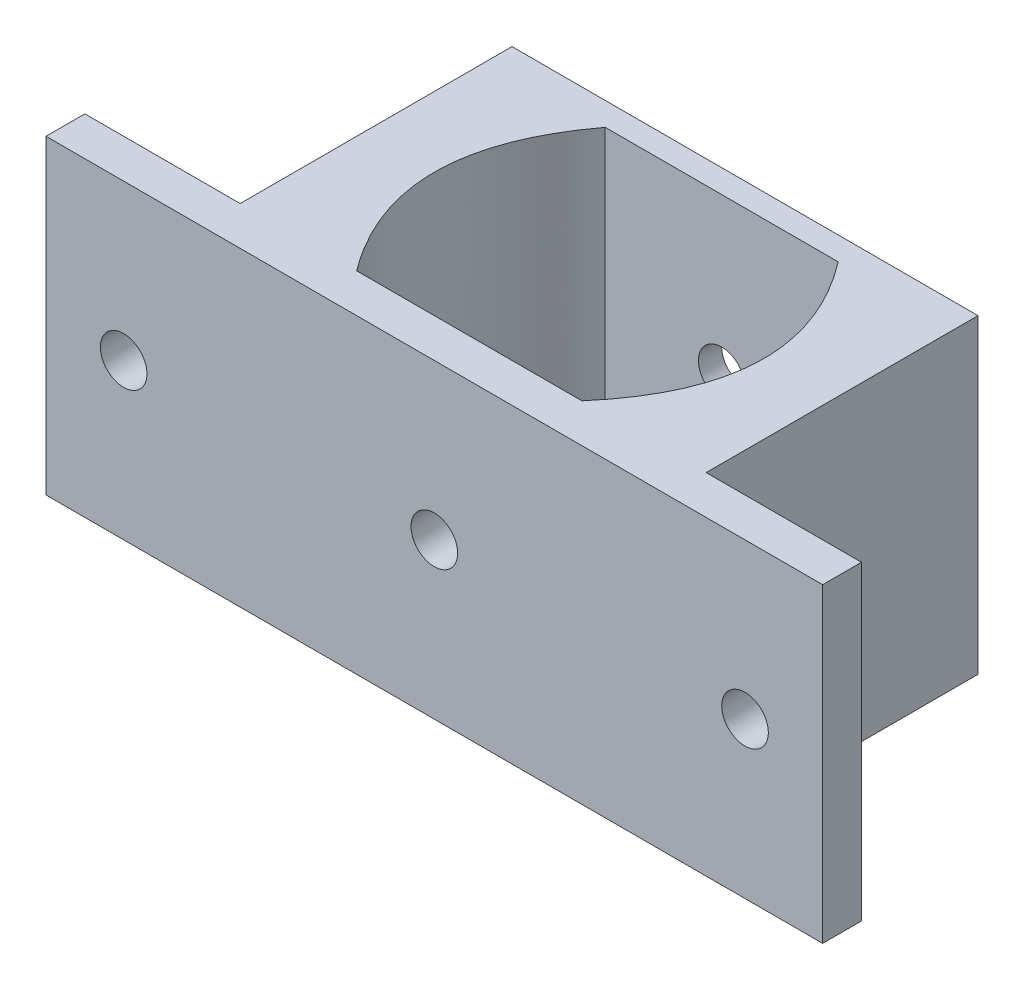
from build123d import *

# Parameters (mm, degrees)
BOSS_EXTRUDE3_DEPTH  = 20
SKETCH3_W            = 10
SKETCH3_H            = 2.5
BOSS_EXTRUDE4_DEPTH  = 20
SKETCH4_R            = 1.5
CUT_EXTRUDE1_DEPTH   = 3
BOSS_EXTRUDE5_DEPTH  = 20
SKETCH6_W            = 20
SKETCH6_H            = 0.5
CUT_EXTRUDE2_DEPTH   = 20
BOSS_EXTRUDE11_DEPTH = 20
CUT_EXTRUDE4_DEPTH   = 20
SKETCH11_W           = 20
SKETCH11_H           = 0.5
CUT_EXTRUDE5_DEPTH   = 20
BOSS_EXTRUDE14_DEPTH = 20
CUT_EXTRUDE9_DEPTH   = 20
CUT_EXTRUDE12_DEPTH  = 20
CUT_EXTRUDE13_DEPTH  = 20
BOSS_EXTRUDE16_DEPTH = 20
BOSS_EXTRUDE17_DEPTH = 20
CUT_EXTRUDE14_DEPTH  = 20


with BuildPart() as part:
    # Sketch1 → Boss-Extrude3 (new body)
    with BuildSketch(Plane(origin=(0, 0, 0), x_dir=(1, 0, 0), z_dir=(0, 1, 0))):
        with BuildLine():
            add(Edge.make_bspline(
                [(-8.130019969, 7.5), (-11.130019969, 3.75), (-11.130019969, 0)],
                knots=[0, 0, 0, 0.5, 0.5, 0.5], degree=2))
            Line((-8.130019969, 7.5), (-13.130019969, 7.5))
            Line((-13.130019969, 7.5), (-13.130019969, -10))
            Line((-13.130019969, -10), (16.869980031, -10))
            Line((16.869980031, -10), (16.869980031, -7.5))
            Line((16.869980031, -7.5), (11.869980031, -7.5))
            Line((11.869980031, -7.5), (-8.130019969, -7.5))
            add(Edge.make_bspline(
                [(-11.130019969, 0), (-11.130019969, -3.75), (-8.130019969, -7.5)],
                knots=[0.5, 0.5, 0.5, 1, 1, 1], degree=2))
        make_face()
        with BuildLine():
            Line((-13.130019969, 7.5), (-8.130019969, 7.5))
            Line((-8.130019969, 7.5), (11.869980031, 7.5))
            add(Edge.make_bspline(
                [(11.869980031, 7.5), (14.869980031, 3.75), (14.869980031, 0)],
                knots=[0, 0, 0, 0.5, 0.5, 0.5], degree=2))
            add(Edge.make_bspline(
                [(14.869980031, 0), (14.869980031, -3.75), (11.869980031, -7.5)],
                knots=[0.5, 0.5, 0.5, 1, 1, 1], degree=2))
            Line((11.869980031, -7.5), (16.869980031, -7.5))
            Line((16.869980031, -7.5), (16.869980031, 10))
            Line((16.869980031, 10), (-13.130019969, 10))
            Line((-13.130019969, 10), (-13.130019969, 7.5))
        make_face()
    extrude(amount=BOSS_EXTRUDE3_DEPTH)

    # Sketch3 → Boss-Extrude4 (add)
    with BuildSketch(Plane(origin=(0, 20, 0), x_dir=(1, 0, 0), z_dir=(0, 1, 0))):
        with Locations((-18.130019969, -8.75)):
            Rectangle(SKETCH3_W, SKETCH3_H)
        with Locations((21.869980031, -8.75)):
            Rectangle(SKETCH3_W, SKETCH3_H)
    extrude(amount=-BOSS_EXTRUDE4_DEPTH)

    # Sketch4 → Cut-Extrude1 (cut)
    with BuildSketch(Plane(origin=(0, 0, 7.5), x_dir=(-1, 0, 0), z_dir=(0, 0, -1))):
        with Locations((18.130019969, 10)):
            Circle(SKETCH4_R)
        with Locations((-21.869980031, 10)):
            Circle(SKETCH4_R)
    extrude(amount=-CUT_EXTRUDE1_DEPTH, mode=Mode.SUBTRACT)

    # Sketch5 → Boss-Extrude5 (add)
    with BuildSketch(Plane(origin=(0, 20, 0), x_dir=(1, 0, 0), z_dir=(0, 1, 0))):
        with BuildLine():
            Line((-8.130019969, 7.5), (-8.130019969, -7.5))
            add(Edge.make_bspline(
                [(-8.130019969, -7.5), (-14.130019969, 0), (-8.130019969, 7.5)],
                knots=[0, 0, 0, 1, 1, 1], degree=2))
        make_face()
        with BuildLine():
            Line((11.869980031, 7.5), (11.869980031, -7.5))
            add(Edge.make_bspline(
                [(11.869980031, 7.5), (17.869980031, 0), (11.869980031, -7.5)],
                knots=[0, 0, 0, 1, 1, 1], degree=2))
        make_face()
    extrude(amount=-BOSS_EXTRUDE5_DEPTH)

    # Sketch6 → Cut-Extrude2 (cut)
    with BuildSketch(Plane(origin=(0, 20, 0), x_dir=(1, 0, 0), z_dir=(0, 1, 0))):
        with Locations((1.869980031, 7.75)):
            Rectangle(SKETCH6_W, SKETCH6_H)
    extrude(amount=-CUT_EXTRUDE2_DEPTH, mode=Mode.SUBTRACT)

    # Sketch8 → Boss-Extrude11 (add)
    with BuildSketch(Plane(origin=(0, 20, 0), x_dir=(1, 0, 0), z_dir=(0, 1, 0))):
        with BuildLine():
            Line((-5.130019969, 8), (-8.130019969, 8))
            Line((-8.130019969, 8), (-8.130019969, 0.25))
            add(Edge.make_bspline(
                [(-8.130019969, 0.25), (-8.130019969, 4.125), (-5.130019969, 8)],
                knots=[0.5, 0.5, 0.5, 1, 1, 1], degree=2))
        make_face()
        with BuildLine():
            add(Edge.make_bspline(
                [(-5.130019969, -7.5), (-8.130019969, -3.625), (-8.130019969, 0.25)],
                knots=[0, 0, 0, 0.5, 0.5, 0.5], degree=2))
            Line((-8.130019969, 0.25), (-8.130019969, -7.5))
            Line((-8.130019969, -7.5), (-5.130019969, -7.5))
        make_face()
        with BuildLine():
            Line((11.869980031, 8), (8.869980031, 8))
            add(Edge.make_bspline(
                [(8.869980031, 8), (11.869980028, 4.125000005), (11.869980031, 0.25000001)],
                knots=[0, 0, 0, 0.499999999, 0.499999999, 0.499999999], degree=2))
            Line((11.869980031, 0.25000001), (11.869980031, 8))
        make_face()
        with BuildLine():
            Line((11.869980031, -7.5), (11.869980031, 0.25000001))
            add(Edge.make_bspline(
                [(11.869980031, 0.25000001), (11.869980035, -3.624999995), (8.869980031, -7.5)],
                knots=[0.499999999, 0.499999999, 0.499999999, 1, 1, 1], degree=2))
            Line((8.869980031, -7.5), (11.869980031, -7.5))
        make_face()
    extrude(amount=-BOSS_EXTRUDE11_DEPTH)

    # Sketch10 → Cut-Extrude4 (cut)
    with BuildSketch(Plane(origin=(0, 20, 0), x_dir=(1, 0, 0), z_dir=(0, 1, 0))):
        with BuildLine():
            add(Edge.make_bspline(
                [(-8.130019969, 0.25), (-8.130019969, 4.125), (-5.130019969, 8)],
                knots=[0.5, 0.5, 0.5, 1, 1, 1], degree=2))
            Line((-5.130019969, 8), (-8.130019969, 8))
            Line((-8.130019969, 8), (-8.130019969, 0.25))
        make_face()
        with BuildLine():
            Line((-8.130019969, -7.5), (-5.130019969, -7.5))
            add(Edge.make_bspline(
                [(-5.130019969, -7.5), (-8.130019969, -3.625), (-8.130019969, 0.25)],
                knots=[0, 0, 0, 0.5, 0.5, 0.5], degree=2))
            Line((-8.130019969, 0.25), (-8.130019969, -7.5))
        make_face()
        with BuildLine():
            add(Edge.make_bspline(
                [(11.869980031, 0.25000001), (11.869980035, -3.624999995), (8.869980031, -7.5)],
                knots=[0.499999999, 0.499999999, 0.499999999, 1, 1, 1], degree=2))
            Line((8.869980031, -7.5), (11.869980031, -7.5))
            Line((11.869980031, -7.5), (11.869980031, 0.25000001))
        make_face()
        with BuildLine():
            Line((11.869980031, 8), (8.869980031, 8))
            add(Edge.make_bspline(
                [(8.869980031, 8), (11.869980028, 4.125000005), (11.869980031, 0.25000001)],
                knots=[0, 0, 0, 0.499999999, 0.499999999, 0.499999999], degree=2))
            Line((11.869980031, 0.25000001), (11.869980031, 8))
        make_face()
    extrude(amount=-CUT_EXTRUDE4_DEPTH, mode=Mode.SUBTRACT)

    # Sketch11 → Cut-Extrude5 (cut)
    with BuildSketch(Plane(origin=(0, 20, 0), x_dir=(1, 0, 0), z_dir=(0, 1, 0))):
        with Locations((1.869980031, 8.25)):
            Rectangle(SKETCH11_W, SKETCH11_H)
    extrude(amount=-CUT_EXTRUDE5_DEPTH, mode=Mode.SUBTRACT)

    # Sketch12 → Boss-Extrude14 (add)
    with BuildSketch(Plane(origin=(0, 20, 0), x_dir=(1, 0, 0), z_dir=(0, 1, 0))):
        with BuildLine():
            Line((-8.130019969, 8.5), (-8.130019969, 0.5))
            add(Edge.make_bspline(
                [(-5.130019969, 8.5), (-8.130019969, 4.5), (-8.130019969, 0.5)],
                knots=[0, 0, 0, 0.5, 0.5, 0.5], degree=2))
            Line((-5.130019969, 8.5), (-8.130019969, 8.5))
        make_face()
        with BuildLine():
            add(Edge.make_bspline(
                [(-8.130019969, 0.5), (-8.130019969, -3.5), (-5.130019969, -7.5)],
                knots=[0.5, 0.5, 0.5, 1, 1, 1], degree=2))
            Line((-8.130019969, 0.5), (-8.130019969, -7.5))
            Line((-8.130019969, -7.5), (-5.130019969, -7.5))
        make_face()
        with BuildLine():
            add(Edge.make_bspline(
                [(11.869980031, 0.5), (11.869980031, -3.5), (8.869980031, -7.5)],
                knots=[0.5, 0.5, 0.5, 1, 1, 1], degree=2))
            Line((8.869980031, -7.5), (11.869980031, -7.5))
            Line((11.869980031, -7.5), (11.869980031, 0.5))
        make_face()
        with BuildLine():
            Line((11.869980031, 8.5), (8.869980031, 8.5))
            add(Edge.make_bspline(
                [(8.869980031, 8.5), (11.869980031, 4.5), (11.869980031, 0.5)],
                knots=[0, 0, 0, 0.5, 0.5, 0.5], degree=2))
            Line((11.869980031, 0.5), (11.869980031, 8.5))
        make_face()
    extrude(amount=-BOSS_EXTRUDE14_DEPTH)

    # Sketch14 → Cut-Extrude9 (cut)
    with BuildSketch(Plane.XY.offset(10)):
        with BuildLine():
            ThreePointArc((0.369980031, 10), (0.80931986, 8.939339828), (1.869980031, 8.5))
            Line((1.869980031, 8.5), (1.869980031, 10))
            Line((1.869980031, 10), (0.369980031, 10))
        make_face()
        with BuildLine():
            Line((1.869980031, 10), (1.869980031, 8.5))
            ThreePointArc((1.869980031, 8.5), (2.930640203, 8.939339828), (3.369980031, 10))
            ThreePointArc((3.369980031, 10), (1.869980031, 11.5), (0.369980031, 10))
            Line((0.369980031, 10), (1.869980031, 10))
        make_face()
        with BuildLine():
            ThreePointArc((0.369980031, 10), (0.80931986, 8.939339828), (1.869980031, 8.5))
            Line((1.869980031, 8.5), (1.869980031, 10))
            Line((1.869980031, 10), (0.369980031, 10))
        make_face()
        with BuildLine():
            Line((1.869980031, 10), (1.869980031, 8.5))
            ThreePointArc((1.869980031, 8.5), (2.930640203, 8.939339828), (3.369980031, 10))
            ThreePointArc((3.369980031, 10), (1.869980031, 11.5), (0.369980031, 10))
            Line((0.369980031, 10), (1.869980031, 10))
        make_face()
    extrude(amount=-CUT_EXTRUDE9_DEPTH, mode=Mode.SUBTRACT)

    # Sketch15 → Cut-Extrude12 (cut)
    with BuildSketch(Plane(origin=(0, 20, 0), x_dir=(1, 0, 0), z_dir=(0, 1, 0))):
        with BuildLine():
            add(Edge.make_bspline(
                [(-5.130019969, 8.5), (-8.130019937, 4.500000043), (-8.130019969, 0.500000085)],
                knots=[0, 0, 0, 0.499999995, 0.499999995, 0.499999995], degree=2))
            Line((-5.130019969, 8.5), (-5.630019969, 8.5))
            add(Edge.make_bspline(
                [(-5.630019969, 8.5), (-8.130019942, 4.500000043), (-8.130019969, 0.500000085)],
                knots=[0, 0, 0, 0.499999995, 0.499999995, 0.499999995], degree=2))
        make_face()
        with BuildLine():
            add(Edge.make_bspline(
                [(-8.130019969, 0.500000085), (-8.13002, -3.499999957), (-5.130019969, -7.5)],
                knots=[0.499999995, 0.499999995, 0.499999995, 1, 1, 1], degree=2))
            add(Edge.make_bspline(
                [(-8.130019969, 0.500000085), (-8.130019995, -3.499999957), (-5.630019969, -7.5)],
                knots=[0.499999995, 0.499999995, 0.499999995, 1, 1, 1], degree=2))
            Line((-5.630019969, -7.5), (-5.130019969, -7.5))
        make_face()
        with BuildLine():
            Line((-4.630019969, 8.5), (-5.130019969, 8.5))
            add(Edge.make_bspline(
                [(-5.130019969, 8.5), (-8.130019937, 4.500000043), (-8.130019969, 0.500000085)],
                knots=[0, 0, 0, 0.499999995, 0.499999995, 0.499999995], degree=2))
            add(Edge.make_bspline(
                [(-8.130019969, 0.500000085), (-8.13002, -3.499999957), (-5.130019969, -7.5)],
                knots=[0.499999995, 0.499999995, 0.499999995, 1, 1, 1], degree=2))
            Line((-5.130019969, -7.5), (-4.630019969, -7.5))
            Line((-4.630019969, -7.5), (-4.630019969, 8.5))
        make_face()
    extrude(amount=-CUT_EXTRUDE12_DEPTH, mode=Mode.SUBTRACT)

    # Sketch17 → Cut-Extrude13 (cut)
    with BuildSketch(Plane(origin=(0, 20, 0), x_dir=(1, 0, 0), z_dir=(0, 1, 0))):
        with BuildLine():
            add(Edge.make_bspline(
                [(-8.130019969, 0.5), (-8.130019968, 4.5), (-5.630019969, 8.5)],
                knots=[0.5, 0.5, 0.5, 1, 1, 1], degree=2))
            add(Edge.make_bspline(
                [(-5.630019969, 8.5), (-8.630019969, 4.5), (-8.630019969, 0.5)],
                knots=[0, 0, 0, 0.5, 0.5, 0.5], degree=2))
            Line((-8.630019969, 0.5), (-8.130019969, 0.5))
        make_face()
        with BuildLine():
            Line((-8.130019969, 0.5), (-8.630019969, 0.5))
            add(Edge.make_bspline(
                [(-8.630019969, 0.5), (-8.630019969, -3.5), (-5.630019969, -7.5)],
                knots=[0.5, 0.5, 0.5, 1, 1, 1], degree=2))
            add(Edge.make_bspline(
                [(-5.630019969, -7.5), (-8.130019969, -3.5), (-8.130019969, 0.5)],
                knots=[0, 0, 0, 0.5, 0.5, 0.5], degree=2))
        make_face()
        with BuildLine():
            add(Edge.make_bspline(
                [(-8.130019969, 0.5), (-8.130019968, 4.5), (-5.630019969, 8.5)],
                knots=[0.5, 0.5, 0.5, 1, 1, 1], degree=2))
            add(Edge.make_bspline(
                [(-5.630019969, 8.5), (-8.630019969, 4.5), (-8.630019969, 0.5)],
                knots=[0, 0, 0, 0.5, 0.5, 0.5], degree=2))
            Line((-8.630019969, 0.5), (-8.130019969, 0.5))
        make_face()
        with BuildLine():
            Line((-8.130019969, 0.5), (-8.630019969, 0.5))
            add(Edge.make_bspline(
                [(-8.630019969, 0.5), (-8.630019969, -3.5), (-5.630019969, -7.5)],
                knots=[0.5, 0.5, 0.5, 1, 1, 1], degree=2))
            add(Edge.make_bspline(
                [(-5.630019969, -7.5), (-8.130019969, -3.5), (-8.130019969, 0.5)],
                knots=[0, 0, 0, 0.5, 0.5, 0.5], degree=2))
        make_face()
        with BuildLine():
            Line((-5.630019969, 0.5), (-5.630019969, 8.5))
            add(Edge.make_bspline(
                [(-8.130019969, 0.5), (-8.130019968, 4.5), (-5.630019969, 8.5)],
                knots=[0.5, 0.5, 0.5, 1, 1, 1], degree=2))
            Line((-8.130019969, 0.5), (-5.630019969, 0.5))
        make_face()
        with BuildLine():
            Line((-5.630019969, -7.5), (-5.630019969, 0.5))
            Line((-5.630019969, 0.5), (-8.130019969, 0.5))
            add(Edge.make_bspline(
                [(-5.630019969, -7.5), (-8.130019969, -3.5), (-8.130019969, 0.5)],
                knots=[0, 0, 0, 0.5, 0.5, 0.5], degree=2))
        make_face()
        with BuildLine():
            Line((-5.630019969, 0.5), (-5.630019969, 8.5))
            add(Edge.make_bspline(
                [(-8.130019969, 0.5), (-8.130019968, 4.5), (-5.630019969, 8.5)],
                knots=[0.5, 0.5, 0.5, 1, 1, 1], degree=2))
            Line((-8.130019969, 0.5), (-5.630019969, 0.5))
        make_face()
        with BuildLine():
            Line((-5.630019969, -7.5), (-5.630019969, 0.5))
            Line((-5.630019969, 0.5), (-8.130019969, 0.5))
            add(Edge.make_bspline(
                [(-5.630019969, -7.5), (-8.130019969, -3.5), (-8.130019969, 0.5)],
                knots=[0, 0, 0, 0.5, 0.5, 0.5], degree=2))
        make_face()
    extrude(amount=-CUT_EXTRUDE13_DEPTH, mode=Mode.SUBTRACT)

    # Sketch18 → Boss-Extrude16 (add)
    with BuildSketch(Plane(origin=(0, 20, 0), x_dir=(1, 0, 0), z_dir=(0, 1, 0))):
        with BuildLine():
            add(Edge.make_bspline(
                [(8.869980031, 8.5), (9.131367244, 8.151483717), (9.369980031, 7.802967433)],
                knots=[0, 0, 0, 0.043564535, 0.043564535, 0.043564535], degree=2))
            Line((8.869980031, 8.5), (8.869980031, -7.5))
            add(Edge.make_bspline(
                [(9.369980031, -6.802967433), (9.131367244, -7.151483717), (8.869980031, -7.5)],
                knots=[0.956435465, 0.956435465, 0.956435465, 1, 1, 1], degree=2))
            Line((9.369980031, -6.802967433), (9.369980031, 7.802967433))
        make_face()
    extrude(amount=-BOSS_EXTRUDE16_DEPTH)

    # Sketch19 → Boss-Extrude17 (add)
    with BuildSketch(Plane(origin=(0, 20, 0), x_dir=(1, 0, 0), z_dir=(0, 1, 0))):
        with BuildLine():
            Line((9.369980032, 7.802967433), (9.369980032, -6.802967433))
            add(Edge.make_bspline(
                [(9.369980032, 7.802967433), (14.369980032, 0.5), (9.369980032, -6.802967433)],
                knots=[0, 0, 0, 1, 1, 1], degree=2))
        make_face()
    extrude(amount=-BOSS_EXTRUDE17_DEPTH)

    # Sketch20 → Cut-Extrude14 (cut)
    with BuildSketch(Plane(origin=(0, 20, 0), x_dir=(1, 0, 0), z_dir=(0, 1, 0))):
        with BuildLine():
            Line((8.869980031, 8.5), (8.869980031, 0.5))
            Line((8.869980031, 0.5), (11.869980031, 0.5))
            add(Edge.make_bspline(
                [(8.869980031, 8.5), (11.869980031, 4.5), (11.869980031, 0.5)],
                knots=[0, 0, 0, 0.5, 0.5, 0.5], degree=2))
        make_face()
        with BuildLine():
            Line((11.869980031, 0.5), (8.869980031, 0.5))
            Line((8.869980031, 0.5), (8.869980031, -7.5))
            add(Edge.make_bspline(
                [(11.869980031, 0.5), (11.869980031, -3.5), (8.869980031, -7.5)],
                knots=[0.5, 0.5, 0.5, 1, 1, 1], degree=2))
        make_face()
        with BuildLine():
            Line((8.869980031, 8.5), (8.869980031, 0.5))
            Line((8.869980031, 0.5), (11.869980031, 0.5))
            add(Edge.make_bspline(
                [(8.869980031, 8.5), (11.869980031, 4.5), (11.869980031, 0.5)],
                knots=[0, 0, 0, 0.5, 0.5, 0.5], degree=2))
        make_face()
        with BuildLine():
            Line((11.869980031, 0.5), (8.869980031, 0.5))
            Line((8.869980031, 0.5), (8.869980031, -7.5))
            add(Edge.make_bspline(
                [(11.869980031, 0.5), (11.869980031, -3.5), (8.869980031, -7.5)],
                knots=[0.5, 0.5, 0.5, 1, 1, 1], degree=2))
        make_face()
        with BuildLine():
            add(Edge.make_bspline(
                [(8.869980031, 8.5), (11.869980031, 4.5), (11.869980031, 0.5)],
                knots=[0, 0, 0, 0.5, 0.5, 0.5], degree=2))
            Line((11.869980031, 0.5), (12.369980031, 0.5))
            add(Edge.make_bspline(
                [(9.369980031, 8.5), (12.458639974, 4.457382103), (12.369980031, 0.5)],
                knots=[0, 0, 0, 0.494555468, 0.494555468, 0.494555468], degree=2))
            Line((9.369980031, 8.5), (8.869980031, 8.5))
        make_face()
        with BuildLine():
            Line((12.369980031, 0.5), (11.869980031, 0.5))
            add(Edge.make_bspline(
                [(11.869980031, 0.5), (11.869980031, -3.5), (8.869980031, -7.5)],
                knots=[0.5, 0.5, 0.5, 1, 1, 1], degree=2))
            add(Edge.make_bspline(
                [(12.369980031, 0.5), (12.279367985, -3.544515269), (8.869980031, -7.5)],
                knots=[0.494555468, 0.494555468, 0.494555468, 1, 1, 1], degree=2))
        make_face()
    extrude(amount=-CUT_EXTRUDE14_DEPTH, mode=Mode.SUBTRACT)


solid = part.part
